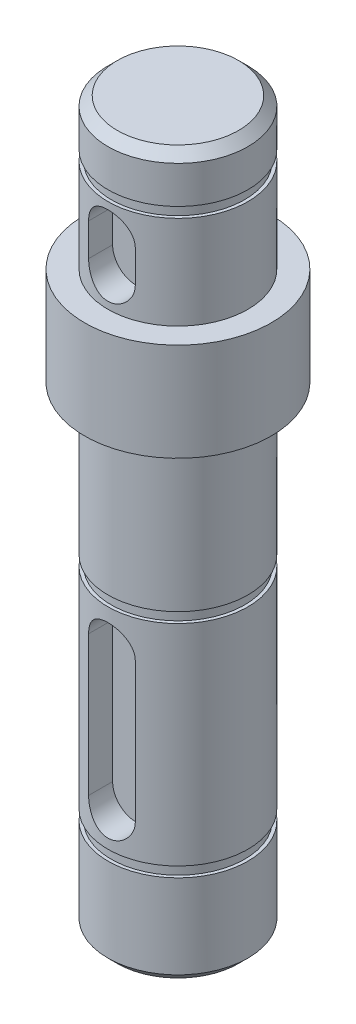
from build123d import *

# Parameters (mm, degrees)
SFAZOWANIE1_SIZE           = 1
WYTNIJ_WYCI_GNI_CIE1_DEPTH = 3


with BuildPart() as part:
    # Szkic1 → Obrót1 (revolve)
    with BuildSketch(Plane.XY, mode=Mode.PRIVATE) as obr_t1_sk:
        Polygon((0, 0), (-7.5, 0), (-7.5, 10), (-7.15, 10), (-7.15, 11.1), (-7.5, 11.1), (-7.5, 33.6), (-7.15, 33.6), (-7.15, 34.7), (-7.5, 34.7), (-7.5, 50.7), (-10, 50.7), (-10, 61.2), (-7.5, 61.2), (-7.5, 71.2), (-7.15, 71.2), (-7.15, 72.3), (-7.5, 72.3), (-7.5, 77.3), (0, 77.3), align=None)
    revolve(obr_t1_sk.sketch.rotate(Axis((0, 0, 0), (0, 1, 0)), 270), axis=Axis((0, 0, 0), (0, 1, 0)))

    # Sfazowanie1
    sfazowanie1_edges = [part.edges().sort_by_distance(p)[0] for p in [
        (0, 77.3, 7.5),
        (0, 0, 7.5),
    ]]
    chamfer(sfazowanie1_edges, length=SFAZOWANIE1_SIZE)

    # Szkic2 → Wytnij-wyciągnięcie1 (cut)
    with BuildSketch(Plane.XY.offset(7.5)):
        with BuildLine():
            Line((-2.5, 14.637705083), (-2.5, 29.637705083))
            ThreePointArc((-2.5, 29.637705083), (0, 32.137705083), (2.5, 29.637705083))
            Line((2.5, 29.637705083), (2.5, 14.637705083))
            ThreePointArc((2.5, 14.637705083), (0, 12.137705083), (-2.5, 14.637705083))
        make_face()
        with BuildLine():
            Line((-2.5, 64.45), (-2.5, 67.95))
            ThreePointArc((-2.5, 67.95), (0, 70.45), (2.5, 67.95))
            Line((2.5, 67.95), (2.5, 64.45))
            ThreePointArc((2.5, 64.45), (0, 61.95), (-2.5, 64.45))
        make_face()
    extrude(amount=-WYTNIJ_WYCI_GNI_CIE1_DEPTH, mode=Mode.SUBTRACT)


solid = part.part
